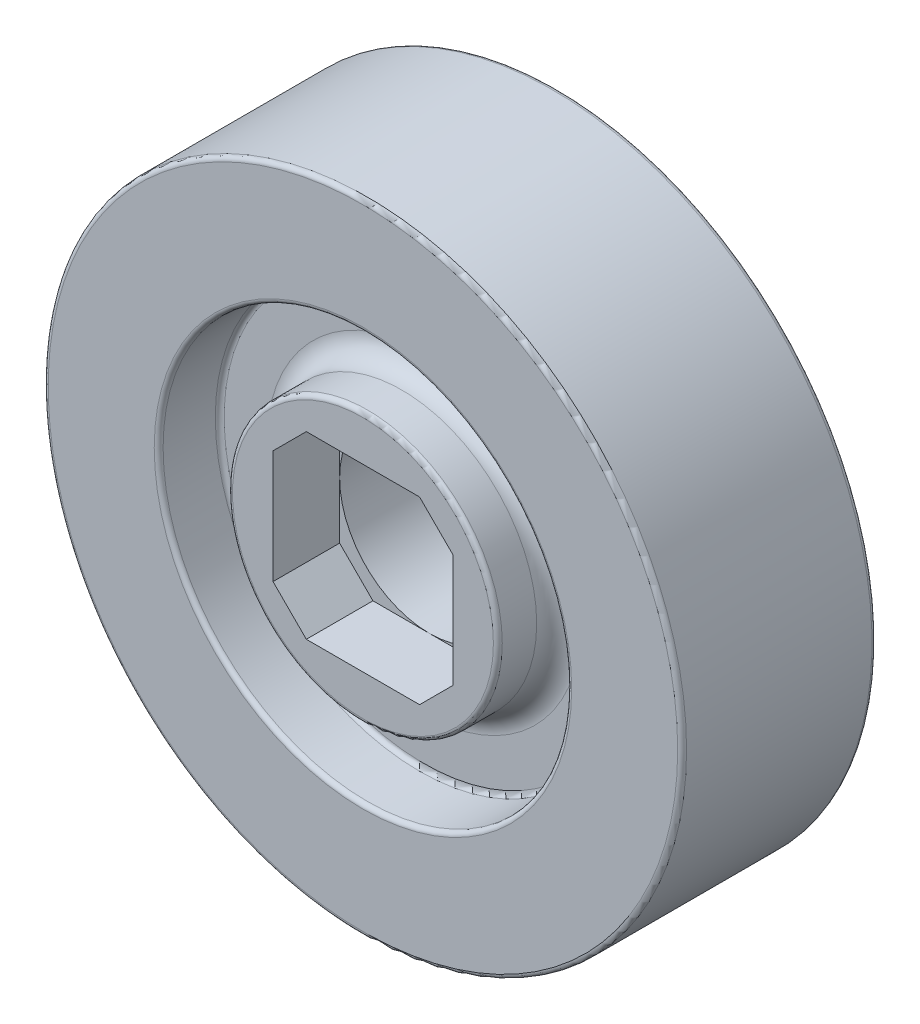
from build123d import *

# Parameters (mm, degrees)
SKETCH2_W          = 20.574
SKETCH2_H          = 20.574
CUT_EXTRUDE1_DEPTH = 7.62
CHAMFER1_SIZE      = 3.81
FILLET1_R          = 2.54
FILLET2_R          = 0.508


with BuildPart() as part:
    # Sketch1 → Revolve1 (revolve)
    with BuildSketch(Plane(origin=(0, 0, 0), x_dir=(1, 0, 0), z_dir=(0, 1, 0))):
        Polygon((-36.5125, 22.225), (-36.5125, 0), (-23.368, 0), (-23.368, 6.985), (-15.4305, 6.985), (-15.4305, 0), (-10.287, 0), (-10.287, 18.288), (-15.494, 18.288), (-15.494, 15.24), (-23.368, 15.24), (-23.368, 22.225), align=None)
    revolve(axis=Axis((0, 0, -23.33625), (0, 0, 1)))

    # Sketch2 → Cut-Extrude1 (cut)
    with BuildSketch(Plane.XY):
        Rectangle(SKETCH2_W, SKETCH2_H)
    extrude(amount=-CUT_EXTRUDE1_DEPTH, mode=Mode.SUBTRACT)

    # Chamfer1
    chamfer1_edges = [part.edges().sort_by_distance(p)[0] for p in [
        (10.287, 10.287, -3.81),
        (10.287, -10.287, -3.81),
        (-10.287, -10.287, -3.81),
        (-10.287, 10.287, -3.81),
    ]]
    chamfer(chamfer1_edges, length=CHAMFER1_SIZE)

    # Fillet1
    fillet1_edges = [part.edges().sort_by_distance(p)[0] for p in [
        (15.4305, 0, -6.985),
        (23.368, 0, -15.24),
        (15.494, 0, -18.288),
    ]]
    fillet(fillet1_edges, radius=FILLET1_R)

    # Fillet2
    fillet2_edges = [part.edges().sort_by_distance(p)[0] for p in [
        (15.4305, 0, 0),
        (23.368, 0, -6.985),
        (23.368, 0, 0),
        (36.5125, 0, 0),
        (36.5125, 0, -22.225),
        (23.368, 0, -22.225),
    ]]
    fillet(fillet2_edges, radius=FILLET2_R)


solid = part.part
